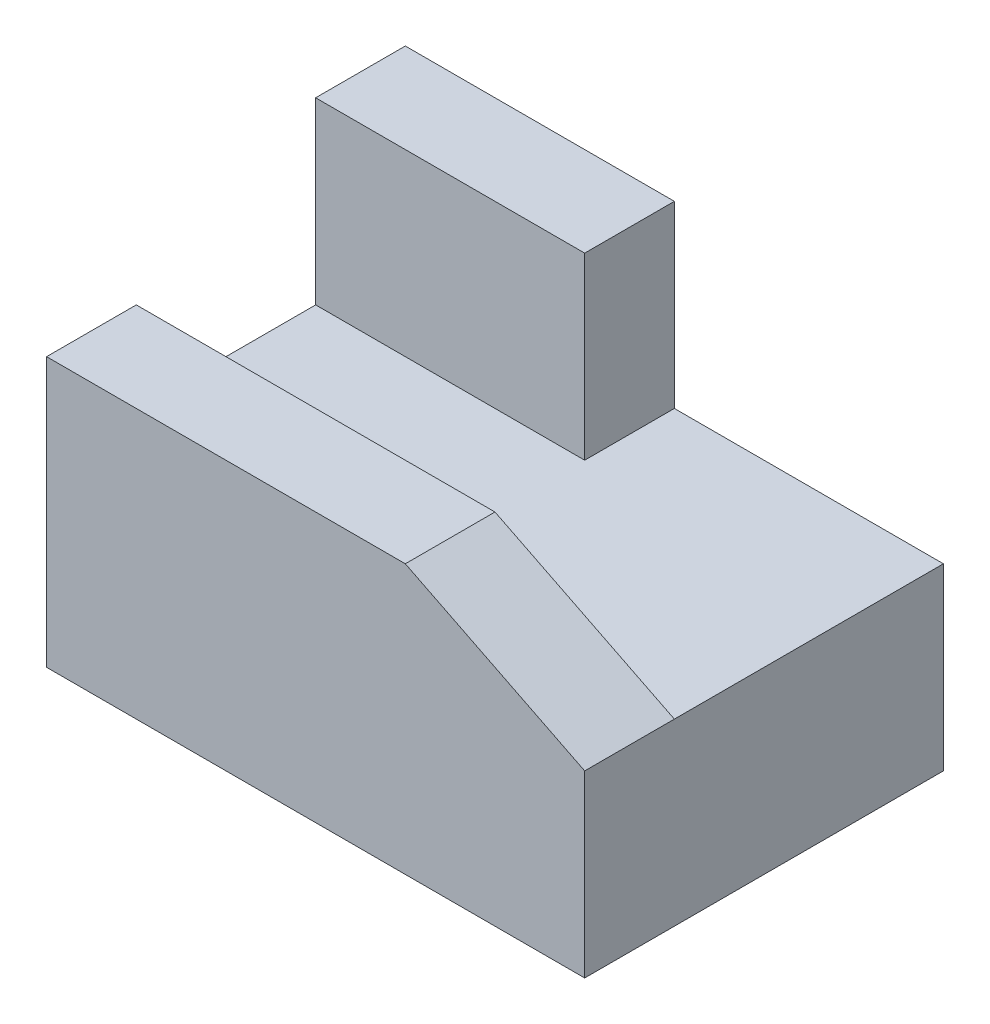
from build123d import *

# Parameters (mm, degrees)
SKETCH1_W           = 60
SKETCH1_H           = 40
BOSS_EXTRUDE1_DEPTH = 20
BOSS_EXTRUDE2_DEPTH = 10
SKETCH3_W           = 30
SKETCH3_H           = 20
BOSS_EXTRUDE3_DEPTH = 10


with BuildPart() as part:
    # Sketch1 → Boss-Extrude1 (new body)
    with BuildSketch(Plane(origin=(0, 0, 0), x_dir=(1, 0, 0), z_dir=(0, 1, 0))):
        Rectangle(SKETCH1_W, SKETCH1_H)
    extrude(amount=BOSS_EXTRUDE1_DEPTH)

    # Sketch2 → Boss-Extrude2 (add)
    with BuildSketch(Plane.XY.offset(20)):
        Polygon((-30, 20), (-30, 30), (10, 30), (30, 20), align=None)
    extrude(amount=-BOSS_EXTRUDE2_DEPTH)

    # Sketch3 → Boss-Extrude3 (add)
    with BuildSketch(Plane(origin=(0, 0, -20), x_dir=(-1, 0, 0), z_dir=(0, 0, -1))):
        with Locations((15, 30)):
            Rectangle(SKETCH3_W, SKETCH3_H)
    extrude(amount=-BOSS_EXTRUDE3_DEPTH)


solid = part.part
